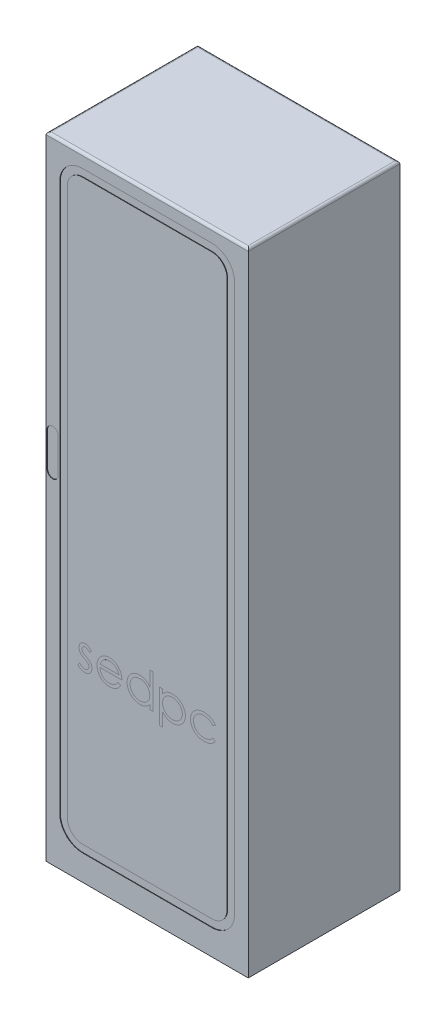
from build123d import *

# Parameters (mm, degrees)
CROQUIS1_W              = 800
CROQUIS1_H              = 600
SALIENTE_EXTRUIR1_DEPTH = 2500
CORTAR_EXTRUIR1_DEPTH   = 2
CORTAR_EXTRUIR2_DEPTH   = 2
CORTAR_EXTRUIR3_DEPTH   = 0.001
REDONDEO1_R             = 10


with BuildPart() as part:
    # Croquis1 → Saliente-Extruir1 (new body)
    with BuildSketch(Plane(origin=(0, 0, 0), x_dir=(1, 0, 0), z_dir=(0, 1, 0))):
        Rectangle(CROQUIS1_W, CROQUIS1_H)
    extrude(amount=SALIENTE_EXTRUIR1_DEPTH)

    # Croquis2 → Cortar-Extruir1 (cut)
    with BuildSketch(Plane.XY.offset(300)):
        with BuildLine():
            Line((-345.995350553, 2356.549502458), (-345.995350553, 190.849800125))
            ThreePointArc((-345.995350553, 190.849800125), (-319.63496086, 127.210189818), (-255.995350553, 100.849800125))
            Line((-255.995350553, 100.849800125), (255.995350553, 100.849800125))
            ThreePointArc((255.995350553, 100.849800125), (319.63496086, 127.210189818), (345.995350553, 190.849800125))
            Line((345.995350553, 190.849800125), (345.995350553, 2356.549502458))
            ThreePointArc((345.995350553, 2356.549502458), (319.63496086, 2420.189112765), (255.995350553, 2446.549502458))
            Line((255.995350553, 2446.549502458), (-255.995350553, 2446.549502458))
            ThreePointArc((-255.995350553, 2446.549502458), (-319.63496086, 2420.189112765), (-345.995350553, 2356.549502458))
        make_face()
        with BuildLine():
            Line((-255.995350553, 2416.549502458), (255.995350553, 2416.549502458))
            ThreePointArc((255.995350553, 2416.549502458), (298.421757424, 2398.975909329), (315.995350553, 2356.549502458))
            Line((315.995350553, 2356.549502458), (315.995350553, 190.849800125))
            ThreePointArc((315.995350553, 190.849800125), (298.421757424, 148.423393254), (255.995350553, 130.849800125))
            Line((255.995350553, 130.849800125), (-255.995350553, 130.849800125))
            ThreePointArc((-255.995350553, 130.849800125), (-298.421757424, 148.423393254), (-315.995350553, 190.849800125))
            Line((-315.995350553, 190.849800125), (-315.995350553, 2356.549502458))
            ThreePointArc((-315.995350553, 2356.549502458), (-298.421757424, 2398.975909329), (-255.995350553, 2416.549502458))
        make_face(mode=Mode.SUBTRACT)
    extrude(amount=-CORTAR_EXTRUIR1_DEPTH, mode=Mode.SUBTRACT)

    # Croquis3 → Cortar-Extruir2 (cut)
    with BuildSketch(Plane.XY.offset(300)):
        with BuildLine():
            Line((-352.039613588, 1482.116331648), (-352.039613588, 1345.934548055))
            ThreePointArc((-352.039613588, 1345.934548055), (-374.032766404, 1323.94139524), (-396.025919219, 1345.934548055))
            Line((-396.025919219, 1345.934548055), (-396.025919219, 1482.116331648))
            ThreePointArc((-396.025919219, 1482.116331648), (-374.032766404, 1504.109484464), (-352.039613588, 1482.116331648))
        make_face()
    extrude(amount=-CORTAR_EXTRUIR2_DEPTH, mode=Mode.SUBTRACT)

    # Croquis4 → Cortar-Extruir3 (cut)
    # profile 1 of 5: a face of its own
    with BuildSketch(Plane.XY.offset(300)):
        with BuildLine():
            Line((-220.486111111, 809.770531321), (-228.542334402, 801.475801419))
            add(Edge.make_bspline(
                [(-228.542334402, 801.475801419), (-229.237451648, 802.281387605), (-230.577555867, 803.834462934), (-232.702971964, 805.910953246), (-234.82053079, 807.654819688), (-236.901244874, 809.127122331), (-238.997435402, 810.240229956), (-241.084503438, 811.052684559), (-243.164609924, 811.555461142), (-244.555034469, 811.620262843), (-245.237797142, 811.652083471)],
                knots=[0, 0, 0, 0, 1.26578478, 2.440284043, 3.530471711, 4.527705817, 5.468200915, 6.346673037, 7.188140097, 8, 8, 8, 8], degree=3))
            add(Edge.make_bspline(
                [(-245.237797142, 811.652083471), (-246.074613365, 811.611455831), (-247.721349262, 811.531506387), (-250.080896562, 810.73346899), (-252.27129221, 809.50849584), (-254.167106633, 807.770992831), (-255.773039777, 805.776629098), (-256.945283077, 803.546708485), (-257.662152101, 801.1485235), (-257.753045247, 799.484299713), (-257.799145299, 798.640222827)],
                knots=[0, 0, 0, 0, 0.99966794, 1.967205029, 2.953328237, 3.988086729, 5.028030931, 6.008226631, 6.989793394, 8, 8, 8, 8], degree=3))
            add(Edge.make_bspline(
                [(-257.799145299, 798.640222827), (-257.75715924, 797.876255682), (-257.673305481, 796.350475005), (-257.02142207, 794.099701107), (-255.983269937, 791.905283294), (-255.012997713, 790.561090108), (-254.51305422, 789.868479705)],
                knots=[0, 0, 0, 0, 0.960159726, 1.917612774, 2.927026955, 4, 4, 4, 4], degree=3))
            add(Edge.make_bspline(
                [(-254.51305422, 789.868479705), (-254.212053116, 789.498645714), (-253.571410203, 788.711500675), (-252.369124072, 787.619003835), (-251.007559232, 786.411662801), (-249.370168728, 785.204526403), (-247.527495948, 783.933327266), (-245.439582527, 782.648127597), (-243.172689035, 781.250960347), (-241.549761077, 780.364816503), (-240.706171541, 779.904203529)],
                knots=[0, 0, 0, 0, 0.66740084, 1.420478572, 2.27185888, 3.217733974, 4.268547843, 5.408967954, 6.65319498, 8, 8, 8, 8], degree=3))
            add(Edge.make_bspline(
                [(-240.706171541, 779.904203529), (-239.677563121, 779.3279825), (-237.690630354, 778.214913211), (-234.867421592, 776.487195251), (-232.305232841, 774.769995583), (-229.982354927, 773.081678981), (-227.943482985, 771.375008092), (-226.126757334, 769.715399421), (-224.577491746, 768.052708304), (-223.709887969, 766.891069781), (-223.295188969, 766.335827461)],
                knots=[0, 0, 0, 0, 1.27191281, 2.456916733, 3.569705269, 4.599008579, 5.553216877, 6.436649441, 7.252746552, 8, 8, 8, 8], degree=3))
            add(Edge.make_bspline(
                [(-223.295188969, 766.335827461), (-222.606874391, 765.214519966), (-221.237000633, 762.982909942), (-219.798488776, 759.308284857), (-218.964662912, 755.410953366), (-218.848918278, 752.74500338), (-218.790064103, 751.389413198)],
                knots=[0, 0, 0, 0, 0.995354457, 1.980940102, 2.973342416, 4, 4, 4, 4], degree=3))
            add(Edge.make_bspline(
                [(-218.790064103, 751.389413198), (-218.817260768, 750.434299635), (-218.870854767, 748.55214402), (-219.243466226, 745.780262064), (-219.884323962, 743.129342776), (-220.757212876, 740.570622194), (-221.935907923, 738.15312656), (-223.317327637, 735.815863577), (-224.975694837, 733.609392383), (-226.86902957, 731.536610258), (-228.942058658, 729.643488257), (-231.153451387, 727.97948762), (-233.505930997, 726.597064755), (-235.982688074, 725.453106766), (-238.589349999, 724.543383921), (-241.326324326, 723.913579912), (-244.18491118, 723.536633287), (-246.128835476, 723.484303384), (-247.119349292, 723.457639026)],
                knots=[0, 0, 0, 0, 1.032770009, 2.035186124, 3.017557409, 3.978232242, 4.952395191, 5.920591857, 6.910227898, 7.931268572, 8.952309245, 9.941945286, 10.918353717, 11.897095711, 12.887975737, 13.898235213, 14.929059601, 16, 16, 16, 16], degree=3))
            add(Edge.make_bspline(
                [(-247.119349292, 723.457639026), (-248.456144316, 723.495160735), (-251.111159709, 723.569682791), (-255.037943737, 724.269167841), (-258.875186698, 725.357565173), (-262.593850275, 726.858732922), (-266.110771842, 728.754310462), (-269.328518099, 731.024525934), (-272.258266829, 733.594385955), (-273.925832533, 735.564129901), (-274.759615385, 736.549001873)],
                knots=[0, 0, 0, 0, 1.013940152, 2.01379169, 3.017749504, 4.037548394, 5.051665909, 6.043208538, 7.021604269, 8, 8, 8, 8], degree=3))
            Line((-274.759615385, 736.549001873), (-266.888897236, 745.506250137))
            add(Edge.make_bspline(
                [(-266.888897236, 745.506250137), (-266.141547102, 744.699090883), (-264.692695867, 743.134290623), (-262.375655827, 741.050721794), (-260.017862988, 739.304423748), (-257.642861442, 737.843794677), (-255.215494781, 736.718355332), (-252.74936591, 735.927682288), (-250.249490953, 735.419523832), (-248.570439986, 735.359868518), (-247.728866186, 735.329968086)],
                knots=[0, 0, 0, 0, 1.179806542, 2.287233372, 3.337373186, 4.324005949, 5.273901747, 6.200048787, 7.097828587, 8, 8, 8, 8], degree=3))
            add(Edge.make_bspline(
                [(-247.728866186, 735.329968086), (-246.58292077, 735.381782002), (-244.343935657, 735.483017702), (-241.13704359, 736.402145883), (-238.176030031, 737.843367276), (-235.604909531, 739.887640093), (-233.416345704, 742.267210844), (-231.831560541, 744.94759571), (-230.838383671, 747.850129936), (-230.721740269, 749.862184231), (-230.662393162, 750.885899243)],
                knots=[0, 0, 0, 0, 1.072336372, 2.095165389, 3.102688358, 4.141489647, 5.156069229, 6.117746104, 7.042326257, 8, 8, 8, 8], degree=3))
            add(Edge.make_bspline(
                [(-230.662393162, 750.885899243), (-230.703452502, 751.72914971), (-230.784518672, 753.394034879), (-231.42115425, 755.803645984), (-232.427056702, 758.089240819), (-233.417530018, 759.426885224), (-233.921983507, 760.108154852)],
                knots=[0, 0, 0, 0, 1.013901739, 2.00181326, 2.98231254, 4, 4, 4, 4], degree=3))
            add(Edge.make_bspline(
                [(-233.921983507, 760.108154852), (-234.225210915, 760.449670028), (-234.885749726, 761.193613426), (-236.097361523, 762.268013728), (-237.548104529, 763.426060928), (-239.254295211, 764.64811801), (-241.219373088, 765.918065293), (-243.451302664, 767.229240215), (-245.919508073, 768.643919136), (-247.664648007, 769.582043013), (-248.57688969, 770.072431027)],
                knots=[0, 0, 0, 0, 0.615000592, 1.339693406, 2.178160186, 3.116406724, 4.166410947, 5.330106347, 6.604359322, 8, 8, 8, 8], degree=3))
            add(Edge.make_bspline(
                [(-248.57688969, 770.072431027), (-249.561390668, 770.621975587), (-251.470652255, 771.687717869), (-254.174969501, 773.34764114), (-256.614705807, 775.035957773), (-258.84856681, 776.657960923), (-260.820128631, 778.299169221), (-262.521624296, 779.961404619), (-264.020043466, 781.577630283), (-264.849603374, 782.722795958), (-265.245851696, 783.269796812)],
                knots=[0, 0, 0, 0, 1.262093308, 2.447601706, 3.550203992, 4.582594899, 5.537233252, 6.418365656, 7.244515135, 8, 8, 8, 8], degree=3))
            add(Edge.make_bspline(
                [(-265.245851696, 783.269796812), (-265.931145195, 784.371431666), (-267.301971675, 786.57508635), (-268.633022056, 790.253190679), (-269.547952314, 794.125369929), (-269.629685514, 796.797164722), (-269.671474359, 798.163209606)],
                knots=[0, 0, 0, 0, 0.985009483, 1.970363186, 2.962279964, 4, 4, 4, 4], degree=3))
            add(Edge.make_bspline(
                [(-269.671474359, 798.163209606), (-269.651283048, 799.056193397), (-269.611765791, 800.803889194), (-269.296380508, 803.371814842), (-268.722169996, 805.811581371), (-268.00193929, 808.159828872), (-267.000944777, 810.371068736), (-265.80480491, 812.474788623), (-264.399208789, 814.468080762), (-262.779834403, 816.320282481), (-260.999315372, 818.00262904), (-259.075614254, 819.4691248), (-257.051995627, 820.720466187), (-254.919891673, 821.769923149), (-252.658820225, 822.563725408), (-250.284585979, 823.110180142), (-247.801994709, 823.475123819), (-246.104839055, 823.50774635), (-245.237797142, 823.524412531)],
                knots=[0, 0, 0, 0, 1.087655834, 2.128696564, 3.144119009, 4.137814668, 5.115653402, 6.093965665, 7.082169637, 8.081268856, 9.086088321, 10.061021666, 11.022561449, 11.980240094, 12.950172527, 13.934149372, 14.944599409, 16, 16, 16, 16], degree=3))
            add(Edge.make_bspline(
                [(-245.237797142, 823.524412531), (-244.210001886, 823.482671082), (-242.135131002, 823.398405157), (-239.02232222, 822.729172209), (-235.914097683, 821.628010238), (-232.802471062, 820.107176419), (-229.71023691, 818.139172479), (-226.610195005, 815.760594795), (-223.465129575, 812.987091895), (-221.501304645, 810.866674744), (-220.486111111, 809.770531321)],
                knots=[0, 0, 0, 0, 0.845714091, 1.707292901, 2.609013841, 3.555613372, 4.552488639, 5.621697636, 6.770543573, 8, 8, 8, 8], degree=3))
        make_face()
    # profile 2 of 5: a face of its own
    with BuildSketch(Plane.XY.offset(300)):
        with BuildLine():
            Line((-115.702206864, 755.682532189), (-105.15491453, 750.143878676))
            add(Edge.make_bspline(
                [(-105.15491453, 750.143878676), (-105.995404886, 748.653014667), (-107.630666278, 745.752383697), (-110.442837403, 741.7673104), (-113.390752052, 738.182292569), (-116.607479414, 735.093106231), (-119.996779779, 732.399973525), (-123.577448576, 730.043752174), (-127.368127103, 728.035998578), (-131.368994677, 726.344459578), (-135.61365033, 725.043862628), (-140.112380266, 724.125220945), (-144.873802859, 723.557377159), (-148.137482872, 723.491414993), (-149.808652177, 723.457639026)],
                knots=[0, 0, 0, 0, 1.120438281, 2.179929193, 3.190490725, 4.156257408, 5.095198341, 6.022838206, 6.959905092, 7.901321166, 8.864066838, 9.862729781, 10.905609505, 12, 12, 12, 12], degree=3))
            add(Edge.make_bspline(
                [(-149.808652177, 723.457639026), (-151.666101923, 723.500999522), (-155.289448271, 723.585583289), (-160.563718475, 724.31479251), (-165.529547682, 725.504372734), (-170.186656708, 727.166165523), (-174.523640659, 729.336781642), (-178.549119398, 731.981083484), (-182.284262191, 735.085487158), (-185.611367717, 738.676882492), (-188.606597807, 742.520218378), (-191.249627312, 746.525098536), (-193.459179021, 750.681446603), (-195.256554466, 754.962802721), (-196.708166922, 759.34218203), (-197.719884594, 763.859430953), (-198.303092331, 768.502323572), (-198.392462742, 771.643205011), (-198.4375, 773.226018433)],
                knots=[0, 0, 0, 0, 1.145258523, 2.234067595, 3.276747158, 4.290159414, 5.277019952, 6.260822364, 7.254936242, 8.264827045, 9.274100331, 10.257902744, 11.220704747, 12.172965371, 13.118907548, 14.062713208, 15.023725156, 16, 16, 16, 16], degree=3))
            add(Edge.make_bspline(
                [(-198.4375, 773.226018433), (-198.397466979, 774.711269464), (-198.318126819, 777.654840867), (-197.818034558, 782.011604009), (-196.931744909, 786.24601278), (-195.715556474, 790.361585664), (-194.1450183, 794.3514318), (-192.223681443, 798.217979443), (-189.948552877, 801.957114194), (-188.191996459, 804.315804069), (-187.307191506, 805.503913065)],
                knots=[0, 0, 0, 0, 1.024358464, 2.0301432, 3.019427413, 4.004406732, 4.986367066, 5.972626655, 6.978780325, 8, 8, 8, 8], degree=3))
            add(Edge.make_bspline(
                [(-187.307191506, 805.503913065), (-186.108716592, 806.93526619), (-183.749731408, 809.752630805), (-179.7599525, 813.454466333), (-175.439677222, 816.555525693), (-170.843047306, 819.126033517), (-165.916638912, 821.079174341), (-160.726674638, 822.534669264), (-155.21405873, 823.350266705), (-151.445438775, 823.465467559), (-149.517144097, 823.524412531)],
                knots=[0, 0, 0, 0, 1.030682036, 2.02871468, 2.997146059, 3.962720338, 4.930598197, 5.918074684, 6.934738563, 8, 8, 8, 8], degree=3))
            add(Edge.make_bspline(
                [(-149.517144097, 823.524412531), (-147.534749492, 823.473232706), (-143.645743172, 823.372829558), (-137.974886216, 822.442012789), (-132.609109133, 820.965919209), (-127.550559119, 818.881237247), (-122.798723311, 816.191575616), (-118.384488699, 812.86002387), (-114.232363076, 808.988864025), (-111.816770958, 806.011802241), (-110.587565104, 804.496885153)],
                knots=[0, 0, 0, 0, 1.056321875, 2.072262726, 3.055038591, 4.01806755, 4.982017516, 5.957941055, 6.960871419, 8, 8, 8, 8], degree=3))
            add(Edge.make_bspline(
                [(-110.587565104, 804.496885153), (-109.751219519, 803.35526169), (-108.084095316, 801.079613752), (-105.995886475, 797.368977754), (-104.183211129, 793.486761837), (-102.734316472, 789.370211917), (-101.56109723, 785.068102786), (-100.71228295, 780.54967922), (-100.214502724, 775.816286738), (-100.116656128, 772.591146099), (-100.066773504, 770.946955266)],
                knots=[0, 0, 0, 0, 0.94817472, 1.890038105, 2.849395472, 3.817997239, 4.812318967, 5.836947057, 6.897266129, 8, 8, 8, 8], degree=3))
            Line((-100.066773504, 770.946955266), (-186.56517094, 770.946955266))
            add(Edge.make_bspline(
                [(-186.56517094, 770.946955266), (-186.506977483, 769.673157956), (-186.392542396, 767.168286922), (-185.859023592, 763.503022204), (-185.018072917, 760.011529807), (-183.836176799, 756.719998161), (-182.404900207, 753.585436793), (-180.651630555, 750.631097896), (-178.559927177, 747.87043804), (-176.226842706, 745.278763494), (-173.62987809, 742.970812105), (-170.897762347, 740.905105086), (-167.991368671, 739.173762591), (-164.933613729, 737.768451282), (-161.729442088, 736.668301835), (-158.377844237, 735.917345518), (-154.885415434, 735.414368562), (-152.504704654, 735.35844074), (-151.292693309, 735.329968086)],
                knots=[0, 0, 0, 0, 1.094153842, 2.151609401, 3.174256925, 4.172055639, 5.149267565, 6.128595816, 7.11444997, 8.118368179, 9.117203808, 10.09244225, 11.054858984, 12.015122123, 12.976791628, 13.957293641, 14.960065497, 16, 16, 16, 16], degree=3))
            add(Edge.make_bspline(
                [(-151.292693309, 735.329968086), (-150.107694575, 735.35295118), (-147.75642977, 735.398554047), (-144.254825935, 735.841992347), (-140.809968799, 736.559023598), (-137.436116157, 737.53760358), (-134.201741922, 738.731133407), (-131.206448809, 740.171330705), (-128.451750183, 741.764490775), (-125.877091029, 743.586701707), (-123.379764792, 745.81707068), (-120.902414859, 748.60032561), (-118.246124688, 751.892026809), (-116.583422819, 754.369496922), (-115.702206864, 755.682532189)],
                knots=[0, 0, 0, 0, 0.99110716, 1.966546729, 2.947904876, 3.932708344, 4.903319531, 5.828989031, 6.710028674, 7.56322171, 8.463672341, 9.504779593, 10.677557249, 12, 12, 12, 12], degree=3))
        make_face()
        with BuildLine():
            add(Edge.make_bspline(
                [(-111.939102564, 782.819284325), (-112.373647599, 784.394041755), (-113.210006911, 787.42494289), (-114.957631401, 791.622024165), (-116.925811659, 795.352191852), (-119.254966387, 798.586898221), (-121.893947981, 801.459650051), (-124.942143872, 803.970114431), (-128.360405323, 806.215952611), (-132.131063319, 808.11159768), (-136.124071266, 809.725172697), (-140.304721975, 810.807133918), (-144.570477647, 811.548327927), (-147.455731923, 811.617350478), (-148.907627204, 811.652083471)],
                knots=[0, 0, 0, 0, 1.154881502, 2.222775134, 3.210006277, 4.132804581, 5.035138423, 5.962687519, 6.919655026, 7.923214229, 8.944639381, 9.960483929, 10.97369054, 12, 12, 12, 12], degree=3))
            add(Edge.make_bspline(
                [(-148.907627204, 811.652083471), (-150.092561338, 811.628963743), (-152.434927002, 811.583260901), (-155.885889996, 811.149717322), (-159.199973854, 810.433080328), (-162.401632046, 809.45166679), (-165.448908916, 808.143544017), (-168.404484977, 806.609594678), (-171.193208287, 804.737040766), (-172.937239396, 803.309845956), (-173.818317642, 802.588832269)],
                knots=[0, 0, 0, 0, 1.04873581, 2.073130211, 3.073294108, 4.04793562, 5.032784715, 6.005352987, 6.992311501, 8, 8, 8, 8], degree=3))
            add(Edge.make_bspline(
                [(-173.818317642, 802.588832269), (-174.449283954, 802.018303077), (-175.726205992, 800.863691042), (-177.432410227, 798.874432342), (-179.066041188, 796.729358415), (-180.552759611, 794.346402812), (-181.91640648, 791.752700749), (-183.192453236, 788.970129417), (-184.340987264, 785.9775736), (-184.987179519, 783.892186761), (-185.319636418, 782.819284325)],
                knots=[0, 0, 0, 0, 0.879870761, 1.780643979, 2.707998968, 3.669668524, 4.684282772, 5.740141944, 6.837334558, 8, 8, 8, 8], degree=3))
            Line((-185.319636418, 782.819284325), (-111.939102564, 782.819284325))
        make_face(mode=Mode.SUBTRACT)
    # profile 3 of 5: a face of its own
    with BuildSketch(Plane.XY.offset(300)):
        with BuildLine():
            Line((22.048611111, 860.837446719), (22.048611111, 725.153686035))
            Line((22.048611111, 725.153686035), (10.176282051, 725.153686035))
            Line((10.176282051, 725.153686035), (10.176282051, 741.87564951))
            add(Edge.make_bspline(
                [(10.176282051, 741.87564951), (8.837536096, 740.36224819), (6.22495653, 737.408826486), (1.861557131, 733.550363418), (-2.763668641, 730.361063765), (-7.628272148, 727.785159213), (-12.727860513, 725.850221369), (-18.051129288, 724.474911188), (-23.600249933, 723.590679918), (-27.389550248, 723.502383854), (-29.309812366, 723.457639026)],
                knots=[0, 0, 0, 0, 1.074387032, 2.096679803, 3.090159297, 4.057316773, 5.018401886, 5.985159533, 6.978961417, 8, 8, 8, 8], degree=3))
            add(Edge.make_bspline(
                [(-29.309812366, 723.457639026), (-31.017053479, 723.503992978), (-34.383808544, 723.595405024), (-39.336395686, 724.304575428), (-44.102382496, 725.443441187), (-48.686272593, 727.027195045), (-53.058404281, 729.128017768), (-57.256211506, 731.643118512), (-61.257947187, 734.638233221), (-65.002615475, 738.062245007), (-68.45096787, 741.781341249), (-71.477093353, 745.74803305), (-74.000200836, 749.945167751), (-76.110066982, 754.319605413), (-77.735226429, 758.905020526), (-78.868158438, 763.685556338), (-79.576502704, 768.655560487), (-79.667876962, 772.03994127), (-79.714209402, 773.756033123)],
                knots=[0, 0, 0, 0, 1.033919861, 2.038935746, 3.024066025, 3.998881131, 4.97069526, 5.957263378, 6.95902576, 7.993208707, 9.027059324, 10.027763471, 11.009749337, 11.988697705, 12.965288445, 13.950418724, 14.960734635, 16, 16, 16, 16], degree=3))
            add(Edge.make_bspline(
                [(-79.714209402, 773.756033123), (-79.666850067, 775.436655252), (-79.573223216, 778.759154539), (-78.875735442, 783.645581516), (-77.702837198, 788.3520753), (-76.056832242, 792.86348357), (-73.946139301, 797.185265228), (-71.378619345, 801.320476888), (-68.354086954, 805.280510661), (-64.867165617, 808.972250484), (-61.089869245, 812.382374892), (-57.048973761, 815.346050122), (-52.844998544, 817.905585776), (-48.412735944, 819.933559434), (-43.817788828, 821.574320231), (-39.019250848, 822.709494918), (-34.037087012, 823.378411525), (-30.654559484, 823.475277908), (-28.938802083, 823.524412531)],
                knots=[0, 0, 0, 0, 1.020392517, 2.01726096, 2.990465484, 3.961182959, 4.928053699, 5.906110375, 6.912531644, 7.948652711, 8.985773172, 9.998621852, 10.987621588, 11.969261332, 12.953316658, 13.946091881, 14.958173133, 16, 16, 16, 16], degree=3))
            add(Edge.make_bspline(
                [(-28.938802083, 823.524412531), (-26.965131077, 823.465180032), (-23.091034228, 823.348913219), (-17.425227015, 822.377273752), (-12.065992927, 820.745819739), (-6.982478222, 818.512309999), (-2.20498919, 815.60942446), (2.301493952, 812.103640568), (6.458601693, 807.89573951), (8.918161652, 804.735421109), (10.176282051, 803.118846959)],
                knots=[0, 0, 0, 0, 1.031072012, 2.023879775, 2.993683497, 3.952812103, 4.918022106, 5.908088563, 6.929940113, 8, 8, 8, 8], degree=3))
            Line((10.176282051, 803.118846959), (10.176282051, 860.837446719))
            Line((10.176282051, 860.837446719), (22.048611111, 860.837446719))
        make_face()
        with BuildLine():
            add(Edge.make_bspline(
                [(-28.779797676, 811.652083471), (-30.515250328, 811.590335854), (-33.940757827, 811.46845588), (-38.969504333, 810.516957699), (-43.781648259, 808.933819757), (-48.353121899, 806.768700279), (-52.61171223, 804.046185532), (-56.41769324, 800.753204675), (-59.802194155, 796.979603247), (-62.648667237, 792.742410384), (-64.969081853, 788.19996468), (-66.600692882, 783.451660026), (-67.67676265, 778.583138553), (-67.786697802, 775.281037037), (-67.841880342, 773.623529451)],
                knots=[0, 0, 0, 0, 1.031046209, 2.035121221, 3.029706178, 4.034933723, 5.034054252, 6.02443088, 7.017295772, 8.038157696, 9.050218397, 10.03989886, 11.016116709, 12, 12, 12, 12], degree=3))
            add(Edge.make_bspline(
                [(-67.841880342, 773.623529451), (-67.771391815, 771.975927185), (-67.630691052, 768.687180699), (-66.619578496, 763.812021993), (-64.923226137, 759.06259838), (-62.608421981, 754.479221541), (-59.709850153, 750.223810605), (-56.350070726, 746.378276211), (-52.496592831, 743.071378082), (-48.228201939, 740.303172175), (-43.66950782, 738.066969749), (-38.875487196, 736.511006589), (-33.936259206, 735.506429762), (-30.577852539, 735.389087929), (-28.885800614, 735.329968086)],
                knots=[0, 0, 0, 0, 0.979072187, 1.954306742, 2.945804271, 3.96968567, 4.997920485, 5.998718438, 6.996577872, 8.005894225, 9.015743152, 10.005417472, 10.995077863, 12, 12, 12, 12], degree=3))
            add(Edge.make_bspline(
                [(-28.885800614, 735.329968086), (-27.168031016, 735.39271077), (-23.751557656, 735.517499746), (-18.70789221, 736.473071381), (-13.813290937, 738.051832509), (-9.134428436, 740.240281644), (-4.775753241, 742.952538846), (-0.86377989, 746.12780687), (2.444115343, 749.820754603), (5.248419336, 753.87932887), (7.447311574, 758.32856207), (9.049025716, 763.065896065), (9.996003702, 768.091495772), (10.115358365, 771.525935868), (10.176282051, 773.279019902)],
                knots=[0, 0, 0, 0, 1.01762866, 2.023962475, 3.030623092, 4.058876274, 5.077231937, 6.066672613, 7.034107872, 8.005628644, 8.981990164, 9.965428785, 10.961468474, 12, 12, 12, 12], degree=3))
            add(Edge.make_bspline(
                [(10.176282051, 773.279019902), (10.140009325, 774.614705758), (10.068613122, 777.243758209), (9.523171952, 781.103935212), (8.655530388, 784.798037357), (7.432922176, 788.32994852), (5.826852795, 791.680141067), (3.889809263, 794.872670099), (1.587728276, 797.890931362), (-1.042331963, 800.693362914), (-3.921195274, 803.249482172), (-6.967477018, 805.531106747), (-10.217268942, 807.405444288), (-13.615918849, 808.956706633), (-17.169323455, 810.191144739), (-20.906397478, 811.014667688), (-24.78741871, 811.580132204), (-27.434992828, 811.627847191), (-28.779797676, 811.652083471)],
                knots=[0, 0, 0, 0, 1.050140795, 2.067009409, 3.05949893, 4.030605086, 5.00011959, 5.97591094, 6.962425594, 7.979863591, 8.993523472, 9.986985069, 10.967611495, 11.937549037, 12.921786183, 13.919465291, 14.943216303, 16, 16, 16, 16], degree=3))
        make_face(mode=Mode.SUBTRACT)
    # profile 4 of 5: a face of its own
    with BuildSketch(Plane.XY.offset(300)):
        with BuildLine():
            Line((49.185363248, 821.828365522), (61.057692308, 821.828365522))
            Line((61.057692308, 821.828365522), (61.057692308, 803.940369729))
            add(Edge.make_bspline(
                [(61.057692308, 803.940369729), (62.318525782, 805.563313834), (64.76870332, 808.717180917), (68.991638712, 812.798950659), (73.448991311, 816.241380291), (78.255465534, 818.939470079), (83.33636096, 820.973768624), (88.67082653, 822.477337117), (94.304136988, 823.363369044), (98.155580289, 823.470021119), (100.119774973, 823.524412531)],
                knots=[0, 0, 0, 0, 1.0828784, 2.104357462, 3.088488658, 4.04616522, 5.001424249, 5.969181776, 6.964304535, 8, 8, 8, 8], degree=3))
            add(Edge.make_bspline(
                [(100.119774973, 823.524412531), (101.835469499, 823.474777495), (105.22662986, 823.37667124), (110.218305477, 822.712451618), (115.025232176, 821.574074553), (119.620215169, 819.933623287), (124.052479835, 817.905574275), (128.256410394, 815.346031561), (132.297488241, 812.382464231), (136.074082293, 808.971903768), (139.563610173, 805.281787746), (142.581605709, 801.312194703), (145.184799712, 797.193668371), (147.28900437, 792.862360124), (148.937296073, 788.352377329), (150.109577043, 783.645498759), (150.80723202, 778.75917601), (150.900835996, 775.436662465), (150.948183761, 773.756033123)],
                knots=[0, 0, 0, 0, 1.041296284, 2.058176809, 3.050446431, 4.034000596, 5.01514041, 6.003636468, 7.015969324, 8.052561599, 9.08815499, 10.094063707, 11.074456064, 12.040834395, 13.011057502, 13.983766392, 14.980127149, 16, 16, 16, 16], degree=3))
            add(Edge.make_bspline(
                [(150.948183761, 773.756033123), (150.901863324, 772.039933961), (150.810512739, 768.655538762), (150.101996146, 763.685639551), (148.96969763, 758.90471798), (147.342200827, 754.320726173), (145.239085047, 749.936820305), (142.680013867, 745.756161883), (139.660495616, 741.780090365), (136.209530372, 738.062584915), (132.465565229, 734.6381466), (128.463648215, 731.643136231), (124.265885256, 729.128030677), (119.893752748, 727.027127145), (115.309822364, 725.443702331), (110.535481213, 724.301541414), (105.573328652, 723.597201844), (102.197957728, 723.504516698), (100.490785256, 723.457639026)],
                knots=[0, 0, 0, 0, 1.038740735, 2.04854663, 3.033179607, 4.009277356, 4.987731542, 5.972001279, 6.972200261, 8.005528982, 9.039189865, 10.040446548, 11.026516639, 11.997840187, 12.972163198, 13.956796175, 14.96660207, 16, 16, 16, 16], degree=3))
            add(Edge.make_bspline(
                [(100.490785256, 723.457639026), (98.569624055, 723.506579675), (94.774767442, 723.603251804), (89.226165019, 724.582943792), (83.88623639, 726.047107729), (78.814142717, 728.190194691), (73.969704565, 730.921281153), (69.380325002, 734.251637153), (65.021626306, 738.174297671), (62.39814054, 741.150172865), (61.057692308, 742.670671545)],
                knots=[0, 0, 0, 0, 1.014726462, 2.004382257, 2.969841629, 3.936926163, 4.907207904, 5.903978561, 6.929055279, 8, 8, 8, 8], degree=3))
            Line((61.057692308, 742.670671545), (61.057692308, 689.536698855))
            Line((61.057692308, 689.536698855), (49.185363248, 689.536698855))
            Line((49.185363248, 689.536698855), (49.185363248, 821.828365522))
        make_face()
        with BuildLine():
            add(Edge.make_bspline(
                [(100.013772035, 811.652083471), (98.668949286, 811.627883235), (96.021339927, 811.580239208), (92.140574508, 811.014259596), (88.402562804, 810.192624735), (84.84497714, 808.948633268), (81.43371872, 807.421654317), (78.195061302, 805.513554489), (75.131278242, 803.258850697), (72.250077987, 800.700732639), (69.647209454, 797.881986986), (67.342955926, 794.873757296), (65.407441716, 791.679853209), (63.800966545, 788.330025519), (62.578467468, 784.79801623), (61.710795917, 781.103941048), (61.165362939, 777.243756679), (61.093965607, 774.614705242), (61.057692308, 773.279019902)],
                knots=[0, 0, 0, 0, 1.05670511, 2.080379991, 3.077984906, 4.06214886, 5.038337365, 6.01289324, 7.01187578, 8.025460281, 9.038092164, 10.024533457, 11.000252242, 11.969694649, 12.940728589, 13.933144304, 14.949937299, 16, 16, 16, 16], degree=3))
            add(Edge.make_bspline(
                [(61.057692308, 773.279019902), (61.117822881, 771.525659696), (61.235623765, 768.090678556), (62.193315948, 763.0717549), (63.751910749, 758.322421492), (65.964156772, 753.882673963), (68.759199013, 749.801179897), (72.126897187, 746.146505188), (76.036779324, 742.941622729), (80.42384282, 740.242069389), (85.126703115, 738.050258549), (90.032301577, 736.481120237), (95.073176539, 735.514550892), (98.481324339, 735.39182886), (100.199277177, 735.329968086)],
                knots=[0, 0, 0, 0, 1.03728447, 2.032128127, 3.01272805, 3.987917167, 4.958271349, 5.931593992, 6.91984656, 7.941419022, 8.973179163, 9.983609215, 10.983593296, 12, 12, 12, 12], degree=3))
            add(Edge.make_bspline(
                [(100.199277177, 735.329968086), (101.882623168, 735.388795427), (105.223762336, 735.505557122), (110.143429428, 736.516196951), (114.924474392, 738.060041628), (119.466998768, 740.311251054), (123.731457979, 743.070101461), (127.582338129, 746.379662237), (130.946587539, 750.215740449), (133.814079531, 754.48719279), (136.124704124, 759.067333779), (137.860757836, 763.80645174), (138.862718789, 768.687841244), (139.004716451, 771.976147655), (139.075854701, 773.623529451)],
                knots=[0, 0, 0, 0, 1.00104056, 1.986885549, 2.97790532, 3.984399681, 4.995088187, 5.994304198, 6.996462723, 8.023150851, 9.048424203, 10.043036403, 11.019596776, 12, 12, 12, 12], degree=3))
            add(Edge.make_bspline(
                [(139.075854701, 773.623529451), (139.020869226, 775.281143623), (138.911326667, 778.583457482), (137.83231661, 783.450388637), (136.210799597, 788.208654399), (133.846216382, 792.726246607), (131.041585067, 796.988838421), (127.649362266, 800.751738014), (123.846309602, 804.046581895), (119.586927512, 806.768592922), (115.015667383, 808.933848237), (110.203466692, 810.516950065), (105.174735292, 811.468457857), (101.749225732, 811.590336519), (100.013772035, 811.652083471)],
                knots=[0, 0, 0, 0, 0.983928682, 1.960191568, 2.949917689, 3.96440592, 4.982380491, 5.975291189, 6.965713506, 7.964880129, 8.970154049, 9.96478489, 10.968906225, 12, 12, 12, 12], degree=3))
        make_face(mode=Mode.SUBTRACT)
    # profile 5 of 5: a face of its own
    with BuildSketch(Plane.XY.offset(300)):
        with BuildLine():
            Line((269.671474359, 800.866284526), (259.733698918, 794.691613385))
            add(Edge.make_bspline(
                [(259.733698918, 794.691613385), (258.64399865, 796.045841367), (256.499108681, 798.711409226), (252.774560164, 802.151368014), (248.805378734, 805.10589608), (244.52373824, 807.513746191), (239.935644011, 809.374199821), (235.059189812, 810.69069866), (229.895071026, 811.511067362), (226.354749515, 811.604307922), (224.540723491, 811.652083471)],
                knots=[0, 0, 0, 0, 1.026593902, 2.0206758, 2.988051866, 3.946915611, 4.916868779, 5.907761954, 6.927957743, 8, 8, 8, 8], degree=3))
            add(Edge.make_bspline(
                [(224.540723491, 811.652083471), (223.090846251, 811.612137351), (220.235352448, 811.533464556), (216.04336391, 811.041698884), (212.050334491, 810.148087261), (208.231236268, 808.970655267), (204.613232353, 807.392593713), (201.186843472, 805.472105907), (197.921677629, 803.240154979), (194.91235437, 800.654399245), (192.159591305, 797.842306747), (189.77460259, 794.827806952), (187.698117317, 791.701192017), (186.068814801, 788.384385094), (184.735497345, 784.953266414), (183.858338576, 781.343070083), (183.273809911, 777.600047178), (183.206933502, 775.048014694), (183.173076923, 773.756033123)],
                knots=[0, 0, 0, 0, 1.112346261, 2.190735716, 3.231507886, 4.247384806, 5.251966152, 6.253067467, 7.256802811, 8.280671706, 9.291813951, 10.270744147, 11.225547591, 12.165006084, 13.100104208, 14.043489273, 15.009504848, 16, 16, 16, 16], degree=3))
            add(Edge.make_bspline(
                [(183.173076923, 773.756033123), (183.24032842, 772.06386354), (183.373925259, 768.702324889), (184.42097448, 763.740325209), (186.134885114, 758.942911913), (188.480524112, 754.344146016), (191.446772942, 750.088355028), (194.930676377, 746.271420889), (198.934165536, 742.967303155), (203.421964942, 740.228014261), (208.288701078, 738.025873283), (213.481719918, 736.456994927), (218.95858662, 735.510074893), (222.708365453, 735.39078776), (224.620225694, 735.329968086)],
                knots=[0, 0, 0, 0, 0.966302908, 1.919585723, 2.883856336, 3.870342332, 4.860282998, 5.839159637, 6.814385684, 7.815993281, 8.834850808, 9.858348828, 10.908058873, 12, 12, 12, 12], degree=3))
            add(Edge.make_bspline(
                [(224.620225694, 735.329968086), (226.372341294, 735.379085986), (229.815713401, 735.475615694), (234.849119712, 736.289359248), (239.641098485, 737.621484685), (244.191479403, 739.479148839), (248.491947584, 741.880337684), (252.514716993, 744.842127771), (256.339833708, 748.279314747), (258.588677763, 750.937166638), (259.733698918, 752.290438172)],
                knots=[0, 0, 0, 0, 1.039848629, 2.043578496, 3.018386758, 3.987534228, 4.954977003, 5.934852016, 6.948509513, 8, 8, 8, 8], degree=3))
            Line((259.733698918, 752.290438172), (269.671474359, 745.771257482))
            add(Edge.make_bspline(
                [(269.671474359, 745.771257482), (269.082296329, 744.906042507), (267.905895824, 743.178484313), (265.939375458, 740.742650141), (263.818179438, 738.462634173), (261.550583216, 736.341492642), (259.166195642, 734.32846632), (256.583563345, 732.519790736), (253.885961959, 730.813801901), (251.041722962, 729.278732029), (248.080253127, 727.898879995), (245.00571959, 726.712368482), (241.831482622, 725.692962694), (238.55381007, 724.882682027), (235.166240104, 724.235933072), (231.677533684, 723.806790186), (228.088892355, 723.486444739), (225.663337827, 723.467324175), (224.434720553, 723.457639026)],
                knots=[0, 0, 0, 0, 0.954134338, 1.905101784, 2.851144739, 3.791306361, 4.734911809, 5.6936923, 6.663572882, 7.643865596, 8.638447847, 9.640600242, 10.646758161, 11.676244097, 12.717260333, 13.78922464, 14.880174919, 16, 16, 16, 16], degree=3))
            add(Edge.make_bspline(
                [(224.434720553, 723.457639026), (222.559547271, 723.491327281), (218.884194028, 723.557356504), (213.504742103, 724.283391139), (208.363749325, 725.377920088), (203.462972104, 726.948930269), (198.801647476, 728.971283381), (194.384121876, 731.441619141), (190.225022379, 734.380451676), (186.365477911, 737.735473018), (182.820762536, 741.373140102), (179.777064269, 745.298419738), (177.137079338, 749.366995059), (175.017103752, 753.668724168), (173.329556235, 758.14643319), (172.176546194, 762.835992854), (171.430809084, 767.698741743), (171.344502774, 771.014835797), (171.300747863, 772.696003743)],
                knots=[0, 0, 0, 0, 1.1129367, 2.181364009, 3.217532258, 4.231199276, 5.232079859, 6.230262199, 7.231623845, 8.250719726, 9.263571943, 10.242672461, 11.195837495, 12.138959767, 13.085126421, 14.0317438, 15.002148558, 16, 16, 16, 16], degree=3))
            add(Edge.make_bspline(
                [(171.300747863, 772.696003743), (171.317417223, 773.836676716), (171.350575331, 776.105663529), (171.730892243, 779.473244918), (172.222203571, 782.795978626), (173.05472399, 786.031746589), (174.016319294, 789.229625112), (175.243817073, 792.351069715), (176.683732298, 795.410585623), (178.318552925, 798.400291474), (180.158871564, 801.271003234), (182.195453893, 803.983120917), (184.351593982, 806.569225148), (186.728161312, 808.940033959), (189.22430299, 811.190360236), (191.910639333, 813.260086959), (194.771762298, 815.155297035), (197.764703359, 816.911034821), (200.887720722, 818.474322992), (204.121937131, 819.821174542), (207.447864129, 820.972209405), (210.87082196, 821.88346915), (214.368091004, 822.647639615), (217.967230862, 823.128343925), (221.654472596, 823.468003646), (224.151232978, 823.505453231), (225.41524773, 823.524412531)],
                knots=[0, 0, 0, 0, 0.990994727, 1.971252077, 2.943264845, 3.907940874, 4.872158414, 5.844625996, 6.82015047, 7.809835459, 8.804511986, 9.781214284, 10.756496977, 11.728388426, 12.696359165, 13.676225489, 14.672885716, 15.677705647, 16.690706858, 17.706033469, 18.721040654, 19.747369689, 20.783475414, 21.830280724, 22.901553713, 24, 24, 24, 24], degree=3))
            add(Edge.make_bspline(
                [(225.41524773, 823.524412531), (226.998216099, 823.489567243), (230.15624042, 823.420050842), (234.840904034, 822.834994642), (239.456567612, 821.952933664), (243.922246821, 820.646163015), (248.183796623, 819.063816504), (252.172785365, 817.286847836), (255.795313101, 815.223301814), (259.118766619, 812.966023681), (262.149361471, 810.419941827), (264.918206875, 807.55461933), (267.482081711, 804.384968484), (268.93565384, 802.048858998), (269.671474359, 800.866284526)],
                knots=[0, 0, 0, 0, 1.095225653, 2.184976855, 3.262915854, 4.344593502, 5.400796181, 6.407717688, 7.363229445, 8.282371371, 9.184954523, 10.097238608, 11.036792983, 12, 12, 12, 12], degree=3))
        make_face()
    extrude(amount=-CORTAR_EXTRUIR3_DEPTH, mode=Mode.SUBTRACT)

    # Redondeo1
    redondeo1_edges = [part.edges().sort_by_distance(p)[0] for p in [
        (-400, 2500, 0),
        (0, 2500, 300),
        (400, 2500, 0),
        (0, 2500, -300),
    ]]
    fillet(redondeo1_edges, radius=REDONDEO1_R)


solid = part.part
